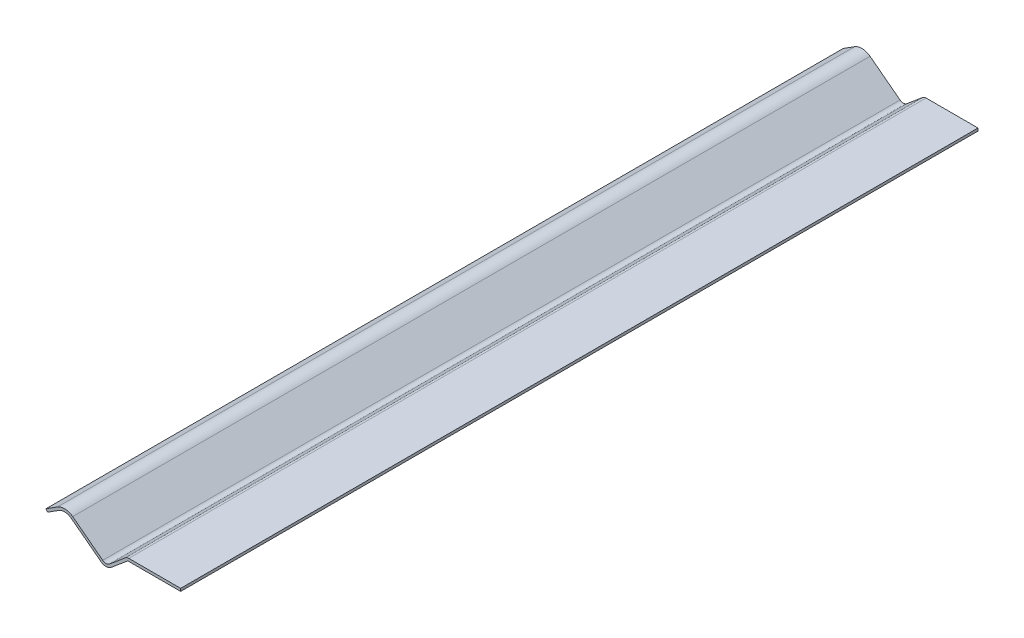
from build123d import *

# Parameters (mm, degrees)
BOSS_EXTRUDE1_DEPTH = 74


with BuildPart() as part:
    # Sketch2 → Boss-Extrude1 (new, symmetric)
    with BuildSketch(Plane.XY):
        with BuildLine():
            Line((10, 0), (0.363970234, 0))
            ThreePointArc((0.363970234, 0), (0.021950091, -0.060307379), (-0.278817375, -0.233955557))
            Line((-0.278817375, -0.233955557), (-3.2177347, -2.7))
            ThreePointArc((-3.2177347, -2.7), (-3.836856667, -2.933675486), (-4.466342204, -2.729557377))
            Line((-4.466342204, -2.729557377), (-10.035554944, 1.511181882))
            ThreePointArc((-10.035554944, 1.511181882), (-11.442705663, 2.019869357), (-12.88832819, 1.633849142))
            Line((-12.88832819, 1.633849142), (-15, 0.295625632))
            Line((-15, 0.295625632), (-14.732355298, -0.126708731))
            Line((-14.732355298, -0.126708731), (-12.620683487, 1.21151478))
            ThreePointArc((-12.620683487, 1.21151478), (-11.464185466, 1.520330952), (-10.338464891, 1.113380972))
            Line((-10.338464891, 1.113380972), (-4.769252151, -3.127358287))
            ThreePointArc((-4.769252151, -3.127358287), (-3.825023846, -3.433535451), (-2.896340895, -3.083022222))
            Line((-2.896340895, -3.083022222), (0.042576429, -0.616977778))
            ThreePointArc((0.042576429, -0.616977778), (0.192960163, -0.53015369), (0.363970234, -0.5))
            Line((0.363970234, -0.5), (10, -0.5))
            Line((10, -0.5), (10, 0))
        make_face()
    extrude(amount=BOSS_EXTRUDE1_DEPTH, both=True)


solid = part.part
